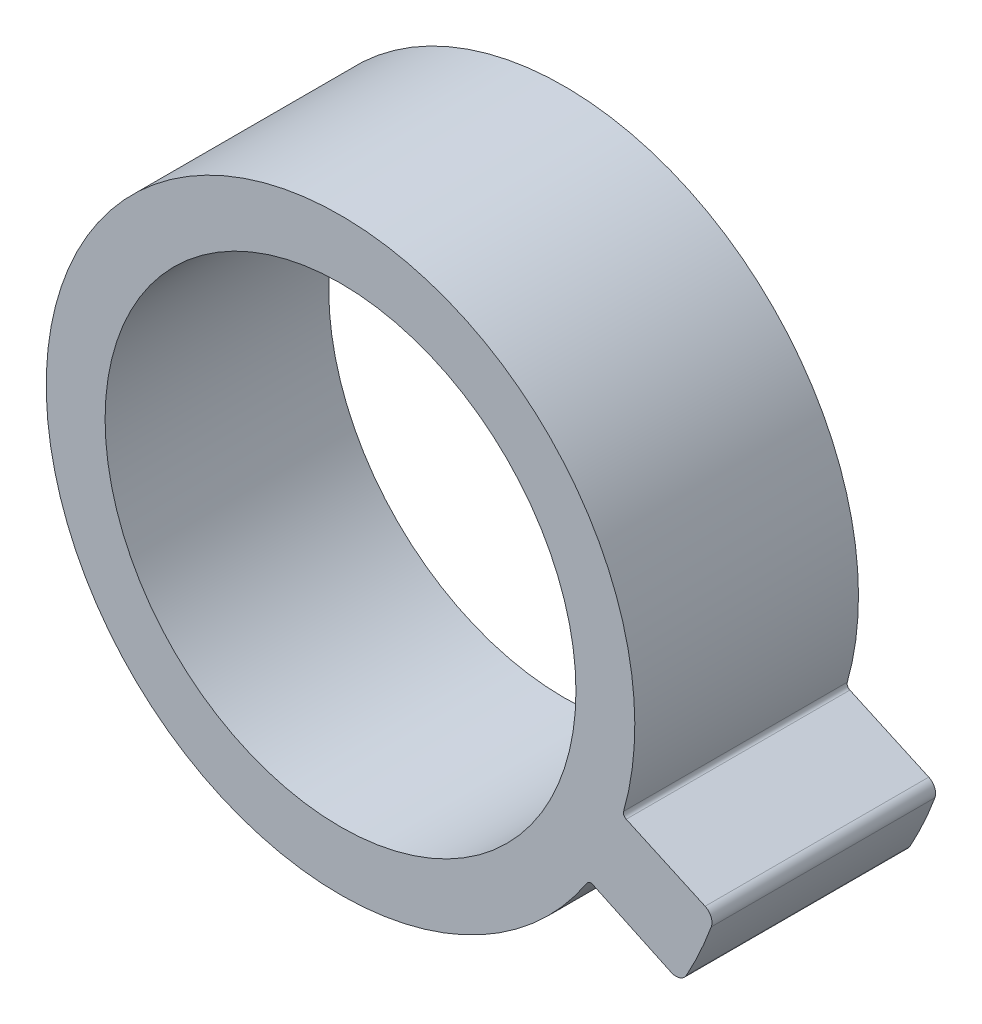
from build123d import *

# Parameters (mm, degrees)
ESQUISSE1_R        = 10
BOSS_EXTRU_3_DEPTH = 9.5


with BuildPart() as part:
    # Esquisse1 → Boss.-Extru.3 (new body)
    with BuildSketch(Plane.XY):
        with BuildLine():
            Line((15.485185595, -5.176669047), (12.134231543, -3.650742984))
            ThreePointArc((12.134231543, -3.650742984), (12.035609724, -3.552721892), (12.024721053, -3.414100701))
            ThreePointArc((12.024721053, -3.414100701), (-11.374079439, 5.184623122), (10.464430261, -6.837082661))
            ThreePointArc((10.464430261, -6.837082661), (10.577237298, -6.754079946), (10.716830338, -6.765422852))
            Line((10.716830338, -6.765422852), (14.040747626, -8.325354826))
            ThreePointArc((14.040747626, -8.325354826), (14.40745115, -8.348324263), (14.690843755, -8.114470246))
            ThreePointArc((14.690843755, -8.114470246), (15.262737454, -6.979567539), (15.747114807, -5.80464408))
            ThreePointArc((15.747114807, -5.80464408), (15.739440197, -5.439232144), (15.485185595, -5.176669047))
        make_face()
        Circle(ESQUISSE1_R, mode=Mode.SUBTRACT)
    extrude(amount=BOSS_EXTRU_3_DEPTH)


solid = part.part
